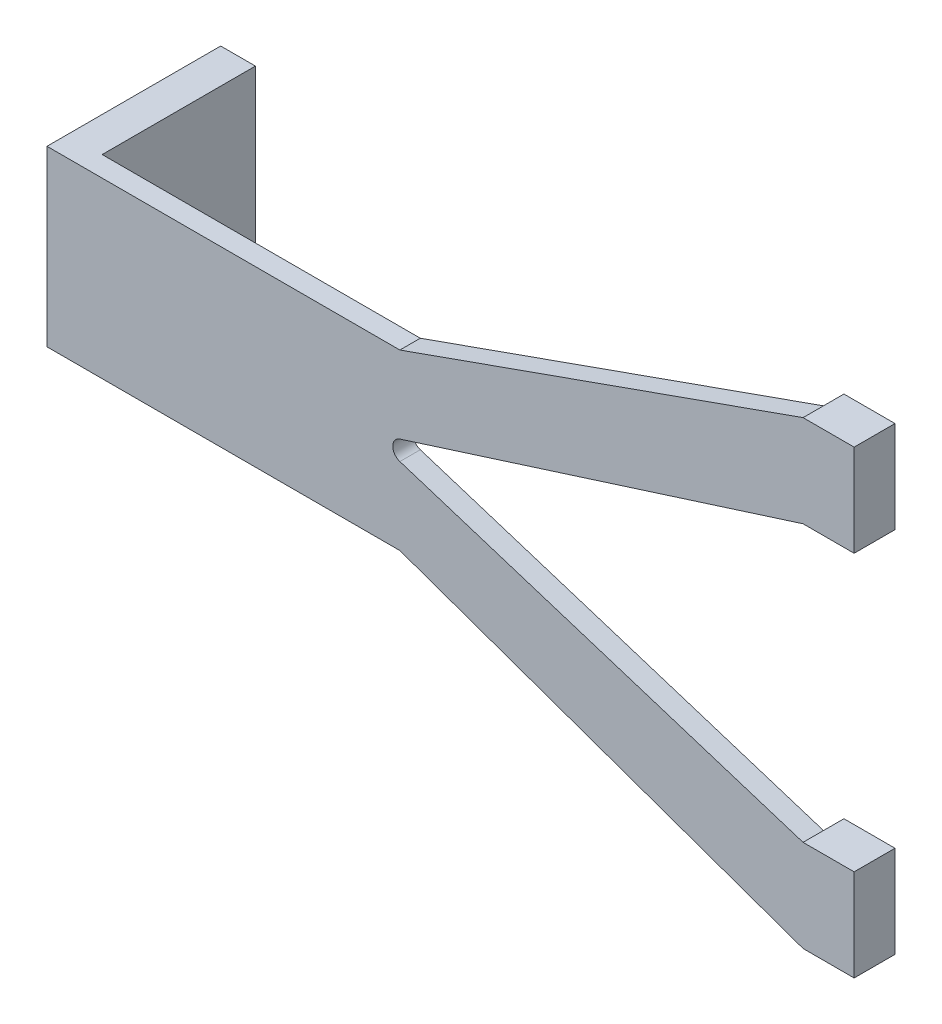
from build123d import *

# Parameters (mm, degrees)
EXTRUDE_1_DEPTH = 2
SKETCH_3_W      = 3.4
SKETCH_3_H      = 17
EXTRUDE_2_DEPTH = 15
SKETCH_6_W      = 5
SKETCH_6_H      = 9
EXTRUDE_4_DEPTH = 2


with BuildPart() as part:
    # 스케치1 → 보스-돌출1 (new body)
    with BuildSketch(Plane.XY):
        with BuildLine():
            Line((30.660415516, 8.5), (70.121524493, 22.5))
            Line((70.121524493, 22.5), (75.121524493, 22.5))
            Line((75.121524493, 22.5), (75.121524493, 13.5))
            Line((75.121524493, 13.5), (70.121524493, 13.5))
            Line((70.121524493, 13.5), (30.660415516, 0.952987126))
            ThreePointArc((30.660415516, 0.952987126), (29.963426304, 0), (30.660415516, -0.952987126))
            Line((30.660415516, -0.952987126), (70.121524493, -13.5))
            Line((70.121524493, -13.5), (75.121524493, -13.5))
            Line((75.121524493, -13.5), (75.121524493, -22.5))
            Line((75.121524493, -22.5), (70.121524493, -22.5))
            Line((70.121524493, -22.5), (30.660415516, -8.5))
            Line((30.660415516, -8.5), (-3.878475507, -8.5))
            Line((-3.878475507, -8.5), (-3.878475507, 8.5))
            Line((-3.878475507, 8.5), (30.660415516, 8.5))
        make_face()
    extrude(amount=EXTRUDE_1_DEPTH)

    # 스케치3 → 보스-돌출2 (add)
    with BuildSketch(Plane(origin=(0, 0, 0), x_dir=(-1, 0, 0), z_dir=(0, 0, -1))):
        with Locations((2.178475507, 0)):
            Rectangle(SKETCH_3_W, SKETCH_3_H)
    extrude(amount=EXTRUDE_2_DEPTH)

    # 스케치6 → 보스-돌출4 (add)
    with BuildSketch(Plane(origin=(0, 0, 0), x_dir=(-1, 0, 0), z_dir=(0, 0, -1))):
        with Locations((-72.621524493, -18)):
            Rectangle(SKETCH_6_W, SKETCH_6_H)
        with Locations((-72.621524493, 18)):
            Rectangle(SKETCH_6_W, SKETCH_6_H)
    extrude(amount=EXTRUDE_4_DEPTH)


solid = part.part
